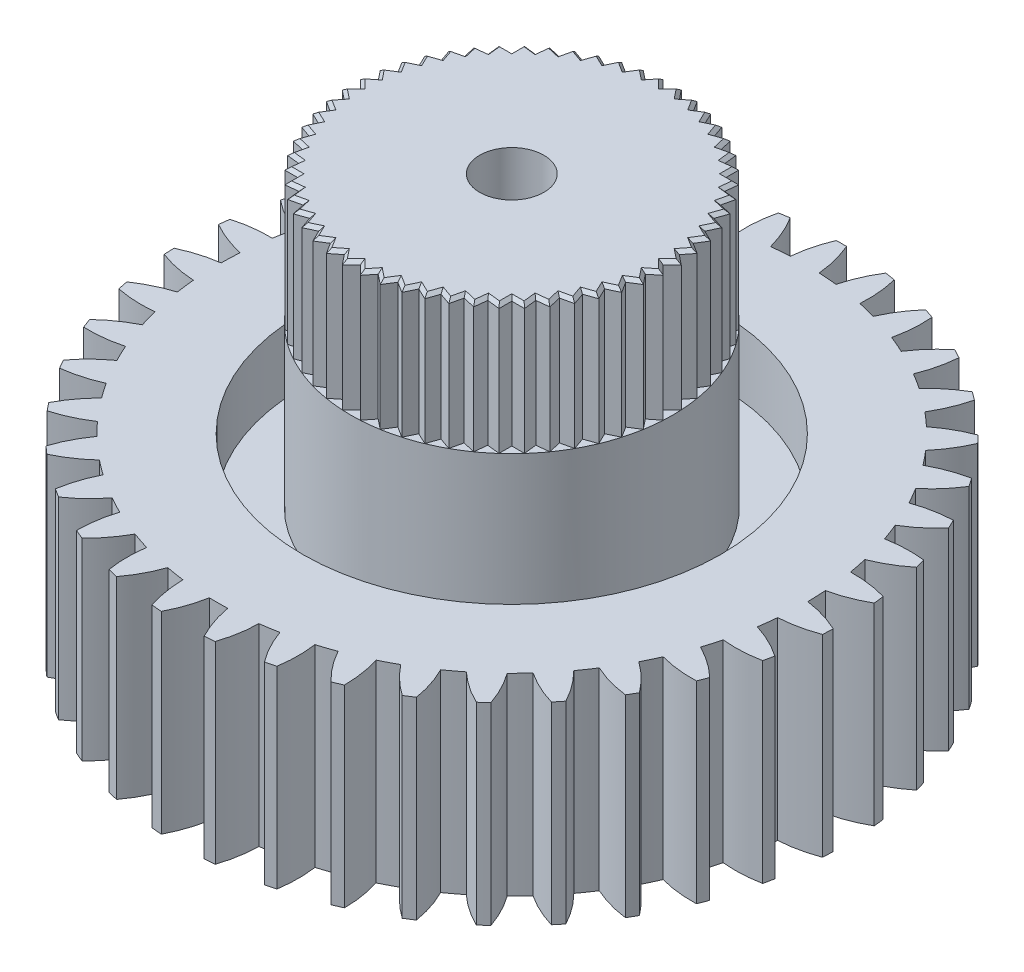
from build123d import *

# Parameters (mm, degrees)
SKETCH1_R                = 0.5
BOSS_EXTRUDE3_DEPTH      = 3
SKETCH2_R                = 3.25
SKETCH2_R_2              = 2.5
CUT_EXTRUDE1_DEPTH       = 1
BOSS_EXTRUDE4_DEPTH      = 3.5
BOSS_EXTRUDE4_DEPTH_BACK = 1
SKETCH2_3_R              = 2.5
CUT_EXTRUDE2_DEPTH       = 2
CIRPATTERN1_COUNT        = 56
CHAMFER1_SIZE            = 0.05
CUT_EXTRUDE3_REACH       = 10.53
SKETCH4_R                = 0.5


with BuildPart() as part:
    # Sketch1 → Boss-Extrude3 (new body)
    with BuildSketch(Plane(origin=(0, 0, 0), x_dir=(1, 0, 0), z_dir=(0, 1, 0))):
        with BuildLine():
            ThreePointArc((-0.225, 4.55444563), (-0.366927553, 4.545213325), (-0.508498148, 4.531559294))
            ThreePointArc((-0.508498148, 4.531559294), (-0.605323937, 4.81009692), (-0.743043628, 5.070849156))
            ThreePointArc((-0.743043628, 5.070849156), (-0.822107814, 5.058632596), (-0.90097167, 5.045183351))
            ThreePointArc((-0.90097167, 5.045183351), (-0.949031928, 4.754238934), (-0.952670766, 4.459374217))
            ThreePointArc((-0.952670766, 4.459374217), (-1.091279429, 4.427494687), (-1.228826461, 4.391307952))
            ThreePointArc((-1.228826461, 4.391307952), (-1.369078959, 4.65070664), (-1.546842816, 4.885990412))
            ThreePointArc((-1.546842816, 4.885990412), (-1.622923468, 4.861249265), (-1.698608647, 4.835323532))
            ThreePointArc((-1.698608647, 4.835323532), (-1.699375771, 4.540437361), (-1.65566786, 4.248807355))
            ThreePointArc((-1.65566786, 4.248807355), (-1.787367741, 4.195106263), (-1.917328814, 4.137324041))
            ThreePointArc((-1.917328814, 4.137324041), (-2.097375555, 4.370865501), (-2.310579588, 4.574587081))
            ThreePointArc((-2.310579588, 4.574587081), (-2.381706257, 4.537962131), (-2.452252552, 4.500231374))
            ThreePointArc((-2.452252552, 4.500231374), (-2.405706674, 4.209040846), (-2.315784026, 3.928198613))
            ThreePointArc((-2.315784026, 3.928198613), (-2.437164167, 3.85406679), (-2.556173359, 3.77618561))
            ThreePointArc((-2.556173359, 3.77618561), (-2.771351226, 3.977821242), (-3.014473563, 4.144704349))
            ThreePointArc((-3.014473563, 4.144704349), (-3.078804104, 4.097144162), (-3.142384405, 4.048585587))
            ThreePointArc((-3.142384405, 4.048585587), (-3.049731038, 3.768632384), (-2.915922602, 3.505851591))
            ThreePointArc((-2.915922602, 3.505851591), (-3.023839322, 3.413209012), (-3.128814355, 3.317245956))
            ThreePointArc((-3.128814355, 3.317245956), (-3.373550355, 3.481753501), (-3.640294255, 3.607475951))
            ThreePointArc((-3.640294255, 3.607475951), (-3.696162543, 3.550212312), (-3.751130152, 3.492083559))
            ThreePointArc((-3.751130152, 3.492083559), (-3.614768969, 3.230618322), (-3.440540314, 2.992704854))
            ThreePointArc((-3.440540314, 2.992704854), (-3.532198626, 2.883950913), (-3.620420704, 2.772391373))
            ThreePointArc((-3.620420704, 2.772391373), (-3.888376303, 2.895510174), (-4.171833239, 2.976815821))
            ThreePointArc((-4.171833239, 2.976815821), (-4.217792313, 2.911331827), (-4.262723598, 2.845138402))
            ThreePointArc((-4.262723598, 2.845138402), (-4.086186284, 2.608932943), (-3.87604984, 2.402048634))
            ThreePointArc((-3.87604984, 2.402048634), (-3.949075841, 2.28), (-4.018260058, 2.155733311))
            ThreePointArc((-4.018260058, 2.155733311), (-4.302495347, 2.234274655), (-4.595323932, 2.269057724))
            ThreePointArc((-4.595323932, 2.269057724), (-4.630183477, 2.197049377), (-4.663914742, 2.124505655))
            ThreePointArc((-4.663914742, 2.124505655), (-4.45177352, 1.919677571), (-4.21117171, 1.749180615))
            ThreePointArc((-4.21117171, 1.749180615), (-4.263674067, 1.616998285), (-4.312028587, 1.483242888))
            ThreePointArc((-4.312028587, 1.483242888), (-4.605182021, 1.515172595), (-4.89979815, 1.502532225))
            ThreePointArc((-4.89979815, 1.502532225), (-4.922655322, 1.425864503), (-4.944312945, 1.348849327))
            ThreePointArc((-4.944312945, 1.348849327), (-4.70206216, 1.180703558), (-4.437226446, 1.051009738))
            ThreePointArc((-4.437226446, 1.051009738), (-4.467845373, 0.912117164), (-4.494117841, 0.772337253))
            ThreePointArc((-4.494117841, 0.772337253), (-4.788596901, 0.756828362), (-5.07737017, 0.69709193))
            ThreePointArc((-5.07737017, 0.69709193), (-5.08763298, 0.617750486), (-5.096656039, 0.53825851))
            ThreePointArc((-5.096656039, 0.53825851), (-4.83056986, 0.411149943), (-4.548359347, 0.32561826))
            ThreePointArc((-4.548359347, 0.32561826), (-4.556301832, 0.183612687), (-4.559811803, 0.04142849))
            ThreePointArc((-4.559811803, 0.04142849), (-4.847989635, -0.021117329), (-5.123440969, -0.12640268))
            ThreePointArc((-5.123440969, -0.12640268), (-5.120843616, -0.206362943), (-5.116998419, -0.28627292))
            ThreePointArc((-5.116998419, -0.28627292), (-4.833968338, -0.369052239), (-4.54169213, -0.40820656))
            ThreePointArc((-4.54169213, -0.40820656), (-4.526752466, -0.549647262), (-4.507409035, -0.69055325))
            ThreePointArc((-4.507409035, -0.69055325), (-4.781821985, -0.798516092), (-5.036817338, -0.946623527))
            ThreePointArc((-5.036817338, -0.946623527), (-5.021427092, -1.025131681), (-5.004813227, -1.103390031))
            ThreePointArc((-5.004813227, -1.103390031), (-4.712169575, -1.139696162), (-4.417397473, -1.131459044))
            ThreePointArc((-4.417397473, -1.131459044), (-4.379962589, -1.268671635), (-4.33826674, -1.404650024))
            ThreePointArc((-4.33826674, -1.404650024), (-4.591807657, -1.555233708), (-4.819742784, -1.742327321))
            ThreePointArc((-4.819742784, -1.742327321), (-4.791958244, -1.817350046), (-4.763006002, -1.89192992))
            ThreePointArc((-4.763006002, -1.89192992), (-4.468328095, -1.880822553), (-4.178694541, -1.825407333))
            ThreePointArc((-4.178694541, -1.825407333), (-4.119733982, -1.95483808), (-4.056765616, -2.082367099))
            ThreePointArc((-4.056765616, -2.082367099), (-4.282867923, -2.271671588), (-4.477839424, -2.492905754))
            ThreePointArc((-4.477839424, -2.492905754), (-4.438380194, -2.5625), (-4.397839424, -2.631469818))
            ThreePointArc((-4.397839424, -2.631469818), (-4.108759265, -2.573236628), (-3.831765616, -2.472078531))
            ThreePointArc((-3.831765616, -2.472078531), (-3.752806428, -2.590375245), (-3.670196393, -2.706151961))
            ThreePointArc((-3.670196393, -2.706151961), (-3.863004159, -2.929274367), (-4.019962374, -3.178919236))
            ThreePointArc((-4.019962374, -3.178919236), (-3.969850429, -3.24128255), (-3.918771114, -3.30285603))
            ThreePointArc((-3.918771114, -3.30285603), (-3.642775728, -3.199005226), (-3.385595974, -3.054724194))
            ThreePointArc((-3.385595974, -3.054724194), (-3.28868316, -3.158823052), (-3.188571012, -3.259848908))
            ThreePointArc((-3.188571012, -3.259848908), (-3.343090616, -3.511010478), (-3.457970411, -3.78260038))
            ThreePointArc((-3.457970411, -3.78260038), (-3.398503623, -3.836117584), (-3.338208691, -3.888700006))
            ThreePointArc((-3.338208691, -3.888700006), (-3.082446214, -3.741921269), (-2.851741175, -3.558254104))
            ThreePointArc((-2.851741175, -3.558254104), (-2.739384725, -3.645459001), (-2.624363316, -3.729117481))
            ThreePointArc((-2.624363316, -3.729117481), (-2.736592783, -4.001813262), (-2.80641883, -4.288314162))
            ThreePointArc((-2.80641883, -4.288314162), (-2.739137359, -4.331599188), (-2.671188416, -4.373828694))
            ThreePointArc((-2.671188416, -4.373828694), (-2.442282961, -4.187923517), (-2.244027777, -3.969627103))
            ThreePointArc((-2.244027777, -3.969627103), (-2.119137665, -4.037679477), (-1.992185988, -4.10180387))
            ThreePointArc((-1.992185988, -4.10180387), (-2.059218634, -4.388971185), (-2.082182476, -4.682962859))
            ThreePointArc((-2.082182476, -4.682962859), (-2.008828876, -4.714894649), (-1.934985765, -4.745677516))
            ThreePointArc((-1.934985765, -4.745677516), (-1.738865863, -4.525460745), (-1.578195239, -4.278188844))
            ThreePointArc((-1.578195239, -4.278188844), (-1.444006052, -4.325326175), (-1.30841209, -4.368255693))
            ThreePointArc((-1.30841209, -4.368255693), (-1.328511804, -4.662457059), (-1.304018689, -4.956325278))
            ThreePointArc((-1.304018689, -4.956325278), (-1.226492779, -4.976076814), (-1.148667999, -4.994615784))
            ThreePointArc((-1.148667999, -4.994615784), (-0.990413052, -4.745790917), (-0.871488273, -4.475947742))
            ThreePointArc((-0.871488273, -4.475947742), (-0.731475441, -4.500949198), (-0.590751007, -4.521571989))
            ThreePointArc((-0.590751007, -4.521571989), (-0.563397216, -4.815187745), (-0.492081504, -5.101321475))
            ThreePointArc((-0.492081504, -5.101321475), (-0.412391165, -5.108381204), (-0.332600334, -5.114196126))
            ThreePointArc((-0.332600334, -5.114196126), (-0.216309063, -4.843207598), (-0.142210218, -4.557781945))
            ThreePointArc((-0.142210218, -4.557781945), (0, -4.56), (0.142210218, -4.557781945))
            ThreePointArc((0.142210218, -4.557781945), (0.216309063, -4.843207598), (0.332600334, -5.114196126))
            ThreePointArc((0.332600334, -5.114196126), (0.412391165, -5.108381204), (0.492081504, -5.101321475))
            ThreePointArc((0.492081504, -5.101321475), (0.563397216, -4.815187745), (0.590751007, -4.521571989))
            ThreePointArc((0.590751007, -4.521571989), (0.731475441, -4.500949198), (0.871488273, -4.475947742))
            ThreePointArc((0.871488273, -4.475947742), (0.990413052, -4.745790917), (1.148667999, -4.994615784))
            ThreePointArc((1.148667999, -4.994615784), (1.226492779, -4.976076814), (1.304018689, -4.956325278))
            ThreePointArc((1.304018689, -4.956325278), (1.328511804, -4.662457059), (1.30841209, -4.368255693))
            ThreePointArc((1.30841209, -4.368255693), (1.444006052, -4.325326175), (1.578195239, -4.278188844))
            ThreePointArc((1.578195239, -4.278188844), (1.738865863, -4.525460745), (1.934985765, -4.745677516))
            ThreePointArc((1.934985765, -4.745677516), (2.008828876, -4.714894649), (2.082182476, -4.682962859))
            ThreePointArc((2.082182476, -4.682962859), (2.059218634, -4.388971185), (1.992185988, -4.10180387))
            ThreePointArc((1.992185988, -4.10180387), (2.119137665, -4.037679477), (2.244027777, -3.969627103))
            ThreePointArc((2.244027777, -3.969627103), (2.442282961, -4.187923517), (2.671188416, -4.373828694))
            ThreePointArc((2.671188416, -4.373828694), (2.739137359, -4.331599188), (2.80641883, -4.288314162))
            ThreePointArc((2.80641883, -4.288314162), (2.736592783, -4.001813262), (2.624363316, -3.729117481))
            ThreePointArc((2.624363316, -3.729117481), (2.739384725, -3.645459001), (2.851741175, -3.558254104))
            ThreePointArc((2.851741175, -3.558254104), (3.082446214, -3.741921269), (3.338208691, -3.888700006))
            ThreePointArc((3.338208691, -3.888700006), (3.398503623, -3.836117584), (3.457970411, -3.78260038))
            ThreePointArc((3.457970411, -3.78260038), (3.343090616, -3.511010478), (3.188571012, -3.259848908))
            ThreePointArc((3.188571012, -3.259848908), (3.28868316, -3.158823052), (3.385595974, -3.054724194))
            ThreePointArc((3.385595974, -3.054724194), (3.642775728, -3.199005226), (3.918771114, -3.30285603))
            ThreePointArc((3.918771114, -3.30285603), (3.969850429, -3.24128255), (4.019962374, -3.178919236))
            ThreePointArc((4.019962374, -3.178919236), (3.863004159, -2.929274367), (3.670196393, -2.706151961))
            ThreePointArc((3.670196393, -2.706151961), (3.752806428, -2.590375245), (3.831765616, -2.472078531))
            ThreePointArc((3.831765616, -2.472078531), (4.108759265, -2.573236628), (4.397839424, -2.631469818))
            ThreePointArc((4.397839424, -2.631469818), (4.438380194, -2.5625), (4.477839424, -2.492905754))
            ThreePointArc((4.477839424, -2.492905754), (4.282867923, -2.271671588), (4.056765616, -2.082367099))
            ThreePointArc((4.056765616, -2.082367099), (4.119733982, -1.95483808), (4.178694541, -1.825407333))
            ThreePointArc((4.178694541, -1.825407333), (4.468328095, -1.880822553), (4.763006002, -1.89192992))
            ThreePointArc((4.763006002, -1.89192992), (4.791958244, -1.817350046), (4.819742784, -1.742327321))
            ThreePointArc((4.819742784, -1.742327321), (4.591807657, -1.555233708), (4.33826674, -1.404650024))
            ThreePointArc((4.33826674, -1.404650024), (4.379962589, -1.268671635), (4.417397473, -1.131459044))
            ThreePointArc((4.417397473, -1.131459044), (4.712169575, -1.139696162), (5.004813227, -1.103390031))
            ThreePointArc((5.004813227, -1.103390031), (5.021427092, -1.025131681), (5.036817338, -0.946623527))
            ThreePointArc((5.036817338, -0.946623527), (4.781821985, -0.798516092), (4.507409035, -0.69055325))
            ThreePointArc((4.507409035, -0.69055325), (4.526752466, -0.549647262), (4.54169213, -0.40820656))
            ThreePointArc((4.54169213, -0.40820656), (4.833968338, -0.369052239), (5.116998419, -0.28627292))
            ThreePointArc((5.116998419, -0.28627292), (5.120843616, -0.206362943), (5.123440969, -0.12640268))
            ThreePointArc((5.123440969, -0.12640268), (4.847989635, -0.021117329), (4.559811803, 0.04142849))
            ThreePointArc((4.559811803, 0.04142849), (4.556301832, 0.183612687), (4.548359347, 0.32561826))
            ThreePointArc((4.548359347, 0.32561826), (4.83056986, 0.411149943), (5.096656039, 0.53825851))
            ThreePointArc((5.096656039, 0.53825851), (5.08763298, 0.617750486), (5.07737017, 0.69709193))
            ThreePointArc((5.07737017, 0.69709193), (4.788596901, 0.756828362), (4.494117841, 0.772337253))
            ThreePointArc((4.494117841, 0.772337253), (4.467845373, 0.912117164), (4.437226446, 1.051009738))
            ThreePointArc((4.437226446, 1.051009738), (4.70206216, 1.180703558), (4.944312945, 1.348849327))
            ThreePointArc((4.944312945, 1.348849327), (4.922655322, 1.425864503), (4.89979815, 1.502532225))
            ThreePointArc((4.89979815, 1.502532225), (4.605182021, 1.515172595), (4.312028587, 1.483242888))
            ThreePointArc((4.312028587, 1.483242888), (4.263674067, 1.616998285), (4.21117171, 1.749180615))
            ThreePointArc((4.21117171, 1.749180615), (4.45177352, 1.919677571), (4.663914742, 2.124505655))
            ThreePointArc((4.663914742, 2.124505655), (4.630183477, 2.197049377), (4.595323932, 2.269057724))
            ThreePointArc((4.595323932, 2.269057724), (4.302495347, 2.234274655), (4.018260058, 2.155733311))
            ThreePointArc((4.018260058, 2.155733311), (3.949075841, 2.28), (3.87604984, 2.402048634))
            ThreePointArc((3.87604984, 2.402048634), (4.086186284, 2.608932943), (4.262723598, 2.845138402))
            ThreePointArc((4.262723598, 2.845138402), (4.217792313, 2.911331827), (4.171833239, 2.976815821))
            ThreePointArc((4.171833239, 2.976815821), (3.888376303, 2.895510174), (3.620420704, 2.772391373))
            ThreePointArc((3.620420704, 2.772391373), (3.532198626, 2.883950913), (3.440540314, 2.992704854))
            ThreePointArc((3.440540314, 2.992704854), (3.614768969, 3.230618322), (3.751130152, 3.492083559))
            ThreePointArc((3.751130152, 3.492083559), (3.696162543, 3.550212312), (3.640294255, 3.607475951))
            ThreePointArc((3.640294255, 3.607475951), (3.373550355, 3.481753501), (3.128814355, 3.317245956))
            ThreePointArc((3.128814355, 3.317245956), (3.023839322, 3.413209012), (2.915922602, 3.505851591))
            ThreePointArc((2.915922602, 3.505851591), (3.049731038, 3.768632384), (3.142384405, 4.048585587))
            ThreePointArc((3.142384405, 4.048585587), (3.078804104, 4.097144162), (3.014473563, 4.144704349))
            ThreePointArc((3.014473563, 4.144704349), (2.771351226, 3.977821242), (2.556173359, 3.77618561))
            ThreePointArc((2.556173359, 3.77618561), (2.437164167, 3.85406679), (2.315784026, 3.928198613))
            ThreePointArc((2.315784026, 3.928198613), (2.405706674, 4.209040846), (2.452252552, 4.500231374))
            ThreePointArc((2.452252552, 4.500231374), (2.381706257, 4.537962131), (2.310579588, 4.574587081))
            ThreePointArc((2.310579588, 4.574587081), (2.097375555, 4.370865501), (1.917328814, 4.137324041))
            ThreePointArc((1.917328814, 4.137324041), (1.787367741, 4.195106263), (1.65566786, 4.248807355))
            ThreePointArc((1.65566786, 4.248807355), (1.699375771, 4.540437361), (1.698608647, 4.835323532))
            ThreePointArc((1.698608647, 4.835323532), (1.622923468, 4.861249265), (1.546842816, 4.885990412))
            ThreePointArc((1.546842816, 4.885990412), (1.369078959, 4.65070664), (1.228826461, 4.391307952))
            ThreePointArc((1.228826461, 4.391307952), (1.091279429, 4.427494687), (0.952670766, 4.459374217))
            ThreePointArc((0.952670766, 4.459374217), (0.949031928, 4.754238934), (0.90097167, 5.045183351))
            ThreePointArc((0.90097167, 5.045183351), (0.822107814, 5.058632596), (0.743043628, 5.070849156))
            ThreePointArc((0.743043628, 5.070849156), (0.605323937, 4.81009692), (0.508498148, 4.531559294))
            ThreePointArc((0.508498148, 4.531559294), (0.366927553, 4.545213325), (0.225, 4.55444563))
            ThreePointArc((0.225, 4.55444563), (0.174108657, 4.844908216), (0.08, 5.124375572))
            ThreePointArc((0.08, 5.124375572), (0, 5.125), (-0.08, 5.124375572))
            ThreePointArc((-0.08, 5.124375572), (-0.174108657, 4.844908216), (-0.225, 4.55444563))
        make_face()
        with Locations(Location((0, 0, 0), (0, 0, 270))):
            Circle(SKETCH1_R, mode=Mode.SUBTRACT)
    extrude(amount=BOSS_EXTRUDE3_DEPTH)

    # Sketch2 → Cut-Extrude1 (cut)
    # profile 1 of 2: a face of its own
    with BuildSketch(Plane(origin=(0, 3, 0), x_dir=(1, 0, 0), z_dir=(0, 1, 0))):
        with Locations(Location((0, 0, 0), (0, 0, 270))):
            Circle(SKETCH2_R)
        Circle(SKETCH2_R_2, mode=Mode.SUBTRACT)
    # profile 2 of 2: a face of its own
    with BuildSketch(Plane(origin=(0, 3, 0), x_dir=(1, 0, 0), z_dir=(0, 1, 0))):
        Circle(SKETCH2_R_2)
    extrude(amount=-CUT_EXTRUDE1_DEPTH, mode=Mode.SUBTRACT)

    # Sketch2<3> → Boss-Extrude4 (add, two sides: drawn at the far end of the back side and taken through both)
    with BuildSketch(Plane(origin=(0, 3, 0), x_dir=(1, 0, 0), z_dir=(0, 1, 0)).offset(-BOSS_EXTRUDE4_DEPTH_BACK)):
        with Locations(Location((0, 0, 0), (0, 0, 270))):
            Circle(SKETCH2_3_R)
    extrude(amount=BOSS_EXTRUDE4_DEPTH + BOSS_EXTRUDE4_DEPTH_BACK)

    # Sketch3 → Cut-Extrude2 (cut)
    with BuildSketch(Plane(origin=(0, 6.5, 0), x_dir=(1, 0, 0), z_dir=(0, 1, 0))):
        with BuildLine():
            Line((-0.141421356, 2.495996795), (0, 2.354575439))
            Line((0, 2.354575439), (0, 2.5))
            ThreePointArc((0, 2.5), (-0.070739002, 2.498998998), (-0.141421356, 2.495996795))
        make_face()
        with BuildLine():
            Line((0, 2.5), (0, 2.354575439))
            Line((0, 2.354575439), (0.141421356, 2.495996795))
            ThreePointArc((0.141421356, 2.495996795), (0.070739002, 2.498998998), (0, 2.5))
        make_face()
    cut_extrude2 = extrude(amount=-CUT_EXTRUDE2_DEPTH, mode=Mode.SUBTRACT)

    # CirPattern1: Cut-Extrude2 ×56 about axis
    cirpattern1_axis = Axis((0, 0, 0), (0, 1, 0))
    for i in range(1, CIRPATTERN1_COUNT):
        add(cut_extrude2.rotate(cirpattern1_axis, i * 360 / CIRPATTERN1_COUNT), mode=Mode.SUBTRACT)

    # Chamfer1
    chamfer1_edges = [part.edges().sort_by_distance(p)[0] for p in [
        (0.070048923, 6.5, -2.424624362),
        (-0.070048923, 6.5, -2.424624362),
        (0.201863326, 6.5, -2.417221824),
        (0.341080267, 6.5, -2.401535842),
        (0.471237027, 6.5, -2.379421319),
        (0.607822328, 6.5, -2.348246615),
        (0.734684649, 6.5, -2.31169821),
        (0.866920671, 6.5, -2.265426825),
        (0.988893185, 6.5, -2.214904155),
        (1.115116983, 6.5, -2.154117978),
        (1.230665816, 6.5, -2.090256395),
        (1.349290053, 6.5, -2.015719847),
        (1.456962109, 6.5, -1.939322449),
        (1.566495017, 6.5, -1.85197287),
        (1.664936259, 6.5, -1.764000397),
        (1.764000397, 6.5, -1.664936259),
        (1.85197287, 6.5, -1.566495017),
        (1.939322449, 6.5, -1.456962109),
        (2.015719847, 6.5, -1.349290053),
        (2.090256395, 6.5, -1.230665816),
        (2.154117978, 6.5, -1.115116983),
        (2.214904155, 6.5, -0.988893185),
        (2.265426825, 6.5, -0.866920671),
        (2.31169821, 6.5, -0.734684649),
        (2.348246615, 6.5, -0.607822328),
        (2.379421319, 6.5, -0.471237027),
        (2.401535842, 6.5, -0.341080267),
        (2.417221824, 6.5, -0.201863326),
        (2.424624362, 6.5, -0.070048923),
        (2.424624362, 6.5, 0.070048923),
        (2.417221824, 6.5, 0.201863326),
        (2.401535842, 6.5, 0.341080267),
        (2.379421319, 6.5, 0.471237027),
        (2.348246615, 6.5, 0.607822328),
        (2.31169821, 6.5, 0.734684649),
        (2.265426825, 6.5, 0.866920671),
        (2.214904155, 6.5, 0.988893185),
        (2.154117978, 6.5, 1.115116983),
        (2.090256395, 6.5, 1.230665816),
        (2.015719847, 6.5, 1.349290053),
        (1.939322449, 6.5, 1.456962109),
        (1.85197287, 6.5, 1.566495017),
        (1.764000397, 6.5, 1.664936259),
        (1.664936259, 6.5, 1.764000397),
        (1.566495017, 6.5, 1.85197287),
        (1.456962109, 6.5, 1.939322449),
        (1.349290053, 6.5, 2.015719847),
        (1.230665816, 6.5, 2.090256395),
        (1.115116983, 6.5, 2.154117978),
        (0.988893185, 6.5, 2.214904155),
        (0.866920671, 6.5, 2.265426825),
        (0.734684649, 6.5, 2.31169821),
        (0.607822328, 6.5, 2.348246615),
        (0.471237027, 6.5, 2.379421319),
        (0.341080267, 6.5, 2.401535842),
        (0.201863326, 6.5, 2.417221824),
        (0.070048923, 6.5, 2.424624362),
        (-0.070048923, 6.5, 2.424624362),
        (-0.201863326, 6.5, 2.417221824),
        (-0.341080267, 6.5, 2.401535842),
        (-0.471237027, 6.5, 2.379421319),
        (-0.607822328, 6.5, 2.348246615),
        (-0.734684649, 6.5, 2.31169821),
        (-0.866920671, 6.5, 2.265426825),
        (-0.988893185, 6.5, 2.214904155),
        (-1.115116983, 6.5, 2.154117978),
        (-1.230665816, 6.5, 2.090256395),
        (-1.349290053, 6.5, 2.015719847),
        (-1.456962109, 6.5, 1.939322449),
        (-1.566495017, 6.5, 1.85197287),
        (-1.664936259, 6.5, 1.764000397),
        (-1.764000397, 6.5, 1.664936259),
        (-1.85197287, 6.5, 1.566495017),
        (-1.939322449, 6.5, 1.456962109),
        (-2.015719847, 6.5, 1.349290053),
        (-2.090256395, 6.5, 1.230665816),
        (-2.154117978, 6.5, 1.115116983),
        (-2.214904155, 6.5, 0.988893185),
        (-2.265426825, 6.5, 0.866920671),
        (-2.31169821, 6.5, 0.734684649),
        (-2.348246615, 6.5, 0.607822328),
        (-2.379421319, 6.5, 0.471237027),
        (-2.401535842, 6.5, 0.341080267),
        (-2.417221824, 6.5, 0.201863326),
        (-2.424624362, 6.5, 0.070048923),
        (-2.424624362, 6.5, -0.070048923),
        (-2.417221824, 6.5, -0.201863326),
        (-2.401535842, 6.5, -0.341080267),
        (-2.379421319, 6.5, -0.471237027),
        (-2.348246615, 6.5, -0.607822328),
        (-2.31169821, 6.5, -0.734684649),
        (-2.265426825, 6.5, -0.866920671),
        (-2.214904155, 6.5, -0.988893185),
        (-2.154117978, 6.5, -1.115116983),
        (-2.090256395, 6.5, -1.230665816),
        (-2.015719847, 6.5, -1.349290053),
        (-1.939322449, 6.5, -1.456962109),
        (-1.85197287, 6.5, -1.566495017),
        (-1.764000397, 6.5, -1.664936259),
        (-1.664936259, 6.5, -1.764000397),
        (-1.566495017, 6.5, -1.85197287),
        (-1.456962109, 6.5, -1.939322449),
        (-1.349290053, 6.5, -2.015719847),
        (-1.230665816, 6.5, -2.090256395),
        (-1.115116983, 6.5, -2.154117978),
        (-0.988893185, 6.5, -2.214904155),
        (-0.866920671, 6.5, -2.265426825),
        (-0.734684649, 6.5, -2.31169821),
        (-0.607822328, 6.5, -2.348246615),
        (-0.471237027, 6.5, -2.379421319),
        (-0.341080267, 6.5, -2.401535842),
        (-0.201863326, 6.5, -2.417221824),
    ]]
    chamfer(chamfer1_edges, length=CHAMFER1_SIZE)

    # Sketch4 → Cut-Extrude3 (cut, up to next)
    with BuildSketch(Plane.XZ.offset(-2), mode=Mode.PRIVATE) as cut_extrude3_sk1:
        with Locations(Location((0, 0, 0), (0, 0, 90))):
            Circle(SKETCH4_R)
    cut_extrude3_tool1 = extrude(cut_extrude3_sk1.sketch, amount=-CUT_EXTRUDE3_REACH, mode=Mode.PRIVATE) & part.part
    add(cut_extrude3_tool1.solids().sort_by_distance((0, 2, 0))[0], mode=Mode.SUBTRACT)


solid = part.part
